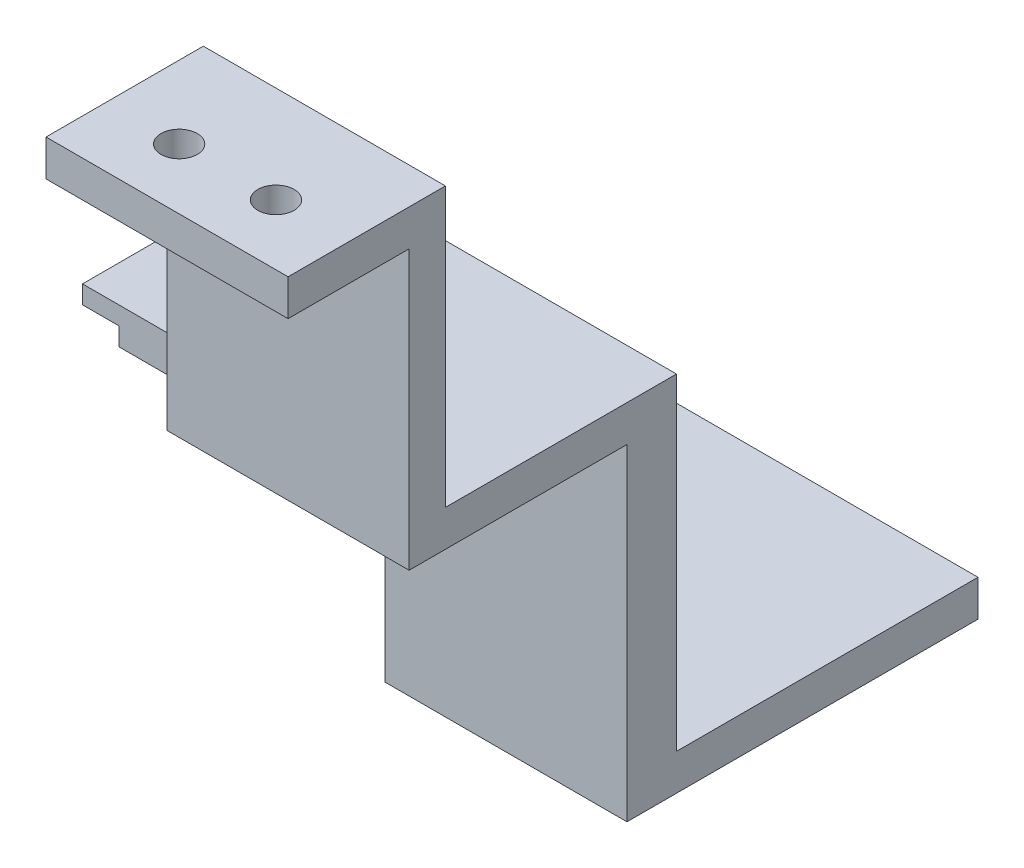
from build123d import *

# Parameters (mm, degrees)
SKETCH_1_W          = 20
SKETCH_1_H          = 10
EXTRUDE_1_DEPTH     = 3
EXTRUDE_4_DEPTH     = 20
CUT_EXTRUDE_1_REACH = 71.606
SKETCH_4_R          = 1.5
SKETCH_5_W          = 55.983974596
SKETCH_5_H          = 16
EXTRUDE_5_DEPTH     = 3
SKETCH_6_W          = 16
SKETCH_6_H          = 3
CUT_EXTRUDE_2_DEPTH = 1
SKETCH_7_W          = 16
SKETCH_7_H          = 1.5
EXTRUDE_6_DEPTH     = 3


with BuildPart() as part:
    # 草图1 → 凸台-拉伸1 (new body)
    with BuildSketch(Plane(origin=(0, 0, 0), x_dir=(1, 0, 0), z_dir=(0, 1, 0))):
        Rectangle(SKETCH_1_W, SKETCH_1_H)
    extrude(amount=EXTRUDE_1_DEPTH)

    # 草图2 → 凸台-拉伸4 (add)
    with BuildSketch(Plane.ZY.offset(10)):
        Polygon((-8, -20), (-8, 3), (-5, 3), (-5, 0), (-5, -23), (-8, -23), (-23, -23), (-23, -50), (-44, -50), (-44, -47), (-27.087778499, -47), (-27.087778499, -20), align=None)
    extrude(amount=-EXTRUDE_4_DEPTH)

    # 草图4 → 切除-拉伸1 (cut, up to next)
    with BuildSketch(Plane(origin=(0, 3, 0), x_dir=(1, 0, 0), z_dir=(0, 1, 0)), mode=Mode.PRIVATE) as cut_extrude_1_sk1:
        with Locations(Location((4, 0, 0), (0, 0, 270))):
            Circle(SKETCH_4_R)
    cut_extrude_1_tool1 = extrude(cut_extrude_1_sk1.sketch, amount=-CUT_EXTRUDE_1_REACH, mode=Mode.PRIVATE) & part.part
    # 草图4 → 切除-拉伸1 (cut, up to next)
    with BuildSketch(Plane(origin=(0, 3, 0), x_dir=(1, 0, 0), z_dir=(0, 1, 0)), mode=Mode.PRIVATE) as cut_extrude_1_sk2:
        with Locations(Location((-4, 0, 0), (0, 0, 270))):
            Circle(SKETCH_4_R)
    cut_extrude_1_tool2 = extrude(cut_extrude_1_sk2.sketch, amount=-CUT_EXTRUDE_1_REACH, mode=Mode.PRIVATE) & part.part
    add(cut_extrude_1_tool1.solids().sort_by_distance((4, 3, 0))[0], mode=Mode.SUBTRACT)
    add(cut_extrude_1_tool2.solids().sort_by_distance((-4, 3, 0))[0], mode=Mode.SUBTRACT)

    # 草图5 → 凸台-拉伸5 (add)
    with BuildSketch(Plane.XZ.offset(50)):
        with Locations((-17.991987298, -44)):
            Rectangle(SKETCH_5_W, SKETCH_5_H)
    extrude(amount=-EXTRUDE_5_DEPTH)

    # 草图6 → 切除-拉伸2 (cut)
    with BuildSketch(Plane.ZY.offset(45.983974596)):
        with Locations((-44, -48.5)):
            Rectangle(SKETCH_6_W, SKETCH_6_H)
    extrude(amount=-CUT_EXTRUDE_2_DEPTH, mode=Mode.SUBTRACT)

    # 草图7 → 凸台-拉伸6 (add)
    with BuildSketch(Plane.ZY.offset(44.983974596)):
        with Locations((-44, -47.75)):
            Rectangle(SKETCH_7_W, SKETCH_7_H)
    extrude(amount=EXTRUDE_6_DEPTH)


solid = part.part
